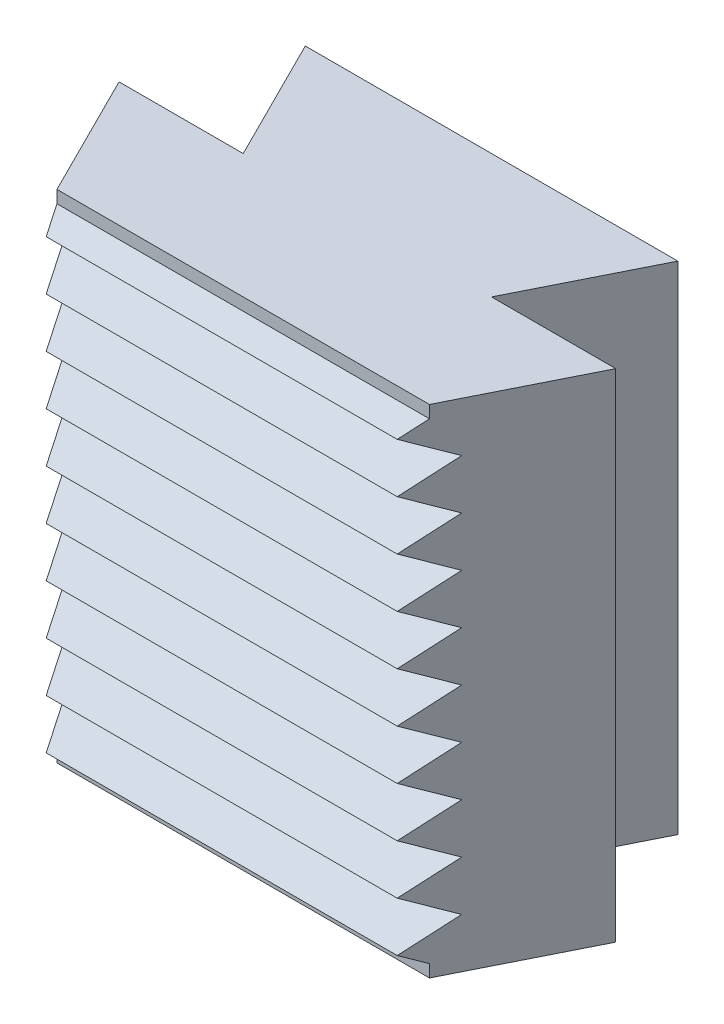
from build123d import *

# Parameters (mm, degrees)
BOSS_EXTRUDE1_DEPTH             = 5
BOSS_EXTRUDE1_DEPTH_BACK        = 5
BOSS_EXTRUDE2_REACH             = 10.66
BOSS_EXTRUDE2_DIRECTION_2_REACH = 10.66
CUT_EXTRUDE1_DEPTH              = 9.660254038
CUT_EXTRUDE1_DEPTH_BACK         = 9.660254038


with BuildPart() as part:
    # Sketch1 → Boss-Extrude1 (new, two sides: drawn at the far end of the back side and taken through both)
    with BuildSketch(Plane(origin=(0, 0, 0), x_dir=(1, 0, 0), z_dir=(0, 1, 0)).offset(-BOSS_EXTRUDE1_DEPTH_BACK)):
        Polygon((-3.75, 0), (3.75, 0), (5, 2.5), (2.5, 2.5), (3.75, 5), (-3.75, 5), (-2.5, 2.5), (-5, 2.5), align=None)
    extrude(amount=BOSS_EXTRUDE1_DEPTH + BOSS_EXTRUDE1_DEPTH_BACK)

    # Boss-Extrude2: up to this plane
    boss_extrude2_end = Plane(origin=(3.75, -5, 0), z_dir=(0.8944271909999159, 0, 0.44721359549995815))
    # Sketch3 → Boss-Extrude2 (add, up to the surface)
    with BuildSketch(Plane(origin=(0, 0, 0), x_dir=(0, 0, -1), z_dir=(1, 0, 0)), mode=Mode.PRIVATE) as boss_extrude2_sk1:
        Polygon((-0.433012702, 4.5), (0.216506351, 4.125), (0.216506351, 4.875), align=None)
    boss_extrude2_tool1 = split(extrude(boss_extrude2_sk1.sketch, amount=BOSS_EXTRUDE2_REACH, mode=Mode.PRIVATE), bisect_by=boss_extrude2_end, keep=Keep.BOTH, mode=Mode.PRIVATE)
    add(boss_extrude2_tool1.solids().sort_by_distance((0, 4.5, 0))[0])
    # Sketch3 → Boss-Extrude2 (add, up to the surface)
    with BuildSketch(Plane(origin=(0, 0, 0), x_dir=(0, 0, -1), z_dir=(1, 0, 0)), mode=Mode.PRIVATE) as boss_extrude2_sk2:
        Polygon((0.216506351, 3.875), (-0.433012702, 3.5), (0.216506351, 3.125), align=None)
    boss_extrude2_tool2 = split(extrude(boss_extrude2_sk2.sketch, amount=BOSS_EXTRUDE2_REACH, mode=Mode.PRIVATE), bisect_by=boss_extrude2_end, keep=Keep.BOTH, mode=Mode.PRIVATE)
    add(boss_extrude2_tool2.solids().sort_by_distance((0, 3.5, 0))[0])
    # Sketch3 → Boss-Extrude2 (add, up to the surface)
    with BuildSketch(Plane(origin=(0, 0, 0), x_dir=(0, 0, -1), z_dir=(1, 0, 0)), mode=Mode.PRIVATE) as boss_extrude2_sk3:
        Polygon((0.216506351, 2.875), (-0.433012702, 2.5), (0.216506351, 2.125), align=None)
    boss_extrude2_tool3 = split(extrude(boss_extrude2_sk3.sketch, amount=BOSS_EXTRUDE2_REACH, mode=Mode.PRIVATE), bisect_by=boss_extrude2_end, keep=Keep.BOTH, mode=Mode.PRIVATE)
    add(boss_extrude2_tool3.solids().sort_by_distance((0, 2.5, 0))[0])
    # Sketch3 → Boss-Extrude2 (add, up to the surface)
    with BuildSketch(Plane(origin=(0, 0, 0), x_dir=(0, 0, -1), z_dir=(1, 0, 0)), mode=Mode.PRIVATE) as boss_extrude2_sk4:
        Polygon((0.216506351, 1.875), (-0.433012702, 1.5), (0.216506351, 1.125), align=None)
    boss_extrude2_tool4 = split(extrude(boss_extrude2_sk4.sketch, amount=BOSS_EXTRUDE2_REACH, mode=Mode.PRIVATE), bisect_by=boss_extrude2_end, keep=Keep.BOTH, mode=Mode.PRIVATE)
    add(boss_extrude2_tool4.solids().sort_by_distance((0, 1.5, 0))[0])
    # Sketch3 → Boss-Extrude2 (add, up to the surface)
    with BuildSketch(Plane(origin=(0, 0, 0), x_dir=(0, 0, -1), z_dir=(1, 0, 0)), mode=Mode.PRIVATE) as boss_extrude2_sk5:
        Polygon((0.216506351, 0.875), (-0.433012702, 0.5), (0.216506351, 0.125), align=None)
    boss_extrude2_tool5 = split(extrude(boss_extrude2_sk5.sketch, amount=BOSS_EXTRUDE2_REACH, mode=Mode.PRIVATE), bisect_by=boss_extrude2_end, keep=Keep.BOTH, mode=Mode.PRIVATE)
    add(boss_extrude2_tool5.solids().sort_by_distance((0, 0.5, 0))[0])
    # Sketch3 → Boss-Extrude2 (add, up to the surface)
    with BuildSketch(Plane(origin=(0, 0, 0), x_dir=(0, 0, -1), z_dir=(1, 0, 0)), mode=Mode.PRIVATE) as boss_extrude2_sk6:
        Polygon((0.216506351, -0.125), (-0.433012702, -0.5), (0.216506351, -0.875), align=None)
    boss_extrude2_tool6 = split(extrude(boss_extrude2_sk6.sketch, amount=BOSS_EXTRUDE2_REACH, mode=Mode.PRIVATE), bisect_by=boss_extrude2_end, keep=Keep.BOTH, mode=Mode.PRIVATE)
    add(boss_extrude2_tool6.solids().sort_by_distance((0, -0.5, 0))[0])
    # Sketch3 → Boss-Extrude2 (add, up to the surface)
    with BuildSketch(Plane(origin=(0, 0, 0), x_dir=(0, 0, -1), z_dir=(1, 0, 0)), mode=Mode.PRIVATE) as boss_extrude2_sk7:
        Polygon((0.216506351, -1.125), (-0.433012702, -1.5), (0.216506351, -1.875), align=None)
    boss_extrude2_tool7 = split(extrude(boss_extrude2_sk7.sketch, amount=BOSS_EXTRUDE2_REACH, mode=Mode.PRIVATE), bisect_by=boss_extrude2_end, keep=Keep.BOTH, mode=Mode.PRIVATE)
    add(boss_extrude2_tool7.solids().sort_by_distance((0, -1.5, 0))[0])
    # Sketch3 → Boss-Extrude2 (add, up to the surface)
    with BuildSketch(Plane(origin=(0, 0, 0), x_dir=(0, 0, -1), z_dir=(1, 0, 0)), mode=Mode.PRIVATE) as boss_extrude2_sk8:
        Polygon((0.216506351, -2.125), (-0.433012702, -2.5), (0.216506351, -2.875), align=None)
    boss_extrude2_tool8 = split(extrude(boss_extrude2_sk8.sketch, amount=BOSS_EXTRUDE2_REACH, mode=Mode.PRIVATE), bisect_by=boss_extrude2_end, keep=Keep.BOTH, mode=Mode.PRIVATE)
    add(boss_extrude2_tool8.solids().sort_by_distance((0, -2.5, 0))[0])
    # Sketch3 → Boss-Extrude2 (add, up to the surface)
    with BuildSketch(Plane(origin=(0, 0, 0), x_dir=(0, 0, -1), z_dir=(1, 0, 0)), mode=Mode.PRIVATE) as boss_extrude2_sk9:
        Polygon((0.216506351, -3.125), (-0.433012702, -3.5), (0.216506351, -3.875), align=None)
    boss_extrude2_tool9 = split(extrude(boss_extrude2_sk9.sketch, amount=BOSS_EXTRUDE2_REACH, mode=Mode.PRIVATE), bisect_by=boss_extrude2_end, keep=Keep.BOTH, mode=Mode.PRIVATE)
    add(boss_extrude2_tool9.solids().sort_by_distance((0, -3.5, 0))[0])
    # Sketch3 → Boss-Extrude2 (add, up to the surface)
    with BuildSketch(Plane(origin=(0, 0, 0), x_dir=(0, 0, -1), z_dir=(1, 0, 0)), mode=Mode.PRIVATE) as boss_extrude2_sk10:
        Polygon((0.216506351, -4.125), (-0.433012702, -4.5), (0.216506351, -4.875), align=None)
    boss_extrude2_tool10 = split(extrude(boss_extrude2_sk10.sketch, amount=BOSS_EXTRUDE2_REACH, mode=Mode.PRIVATE), bisect_by=boss_extrude2_end, keep=Keep.BOTH, mode=Mode.PRIVATE)
    add(boss_extrude2_tool10.solids().sort_by_distance((0, -4.5, 0))[0])

    # Boss-Extrude2 direction 2: up to this plane
    boss_extrude2_direction_2_end = Plane(origin=(-5, -5, -2.5), z_dir=(-0.8944271909999154, 0, 0.44721359549995904))
    # Sketch3 → Boss-Extrude2 direction 2 (add, up to the surface)
    with BuildSketch(Plane(origin=(0, 0, 0), x_dir=(0, 0, -1), z_dir=(1, 0, 0)), mode=Mode.PRIVATE) as boss_extrude2_direction_2_sk1:
        Polygon((-0.433012702, 4.5), (0.216506351, 4.125), (0.216506351, 4.875), align=None)
    boss_extrude2_direction_2_tool1 = split(extrude(boss_extrude2_direction_2_sk1.sketch, amount=-BOSS_EXTRUDE2_DIRECTION_2_REACH, mode=Mode.PRIVATE), bisect_by=boss_extrude2_direction_2_end, keep=Keep.BOTH, mode=Mode.PRIVATE)
    add(boss_extrude2_direction_2_tool1.solids().sort_by_distance((0, 4.5, 0))[0])
    # Sketch3 → Boss-Extrude2 direction 2 (add, up to the surface)
    with BuildSketch(Plane(origin=(0, 0, 0), x_dir=(0, 0, -1), z_dir=(1, 0, 0)), mode=Mode.PRIVATE) as boss_extrude2_direction_2_sk2:
        Polygon((0.216506351, 3.875), (-0.433012702, 3.5), (0.216506351, 3.125), align=None)
    boss_extrude2_direction_2_tool2 = split(extrude(boss_extrude2_direction_2_sk2.sketch, amount=-BOSS_EXTRUDE2_DIRECTION_2_REACH, mode=Mode.PRIVATE), bisect_by=boss_extrude2_direction_2_end, keep=Keep.BOTH, mode=Mode.PRIVATE)
    add(boss_extrude2_direction_2_tool2.solids().sort_by_distance((0, 3.5, 0))[0])
    # Sketch3 → Boss-Extrude2 direction 2 (add, up to the surface)
    with BuildSketch(Plane(origin=(0, 0, 0), x_dir=(0, 0, -1), z_dir=(1, 0, 0)), mode=Mode.PRIVATE) as boss_extrude2_direction_2_sk3:
        Polygon((0.216506351, 2.875), (-0.433012702, 2.5), (0.216506351, 2.125), align=None)
    boss_extrude2_direction_2_tool3 = split(extrude(boss_extrude2_direction_2_sk3.sketch, amount=-BOSS_EXTRUDE2_DIRECTION_2_REACH, mode=Mode.PRIVATE), bisect_by=boss_extrude2_direction_2_end, keep=Keep.BOTH, mode=Mode.PRIVATE)
    add(boss_extrude2_direction_2_tool3.solids().sort_by_distance((0, 2.5, 0))[0])
    # Sketch3 → Boss-Extrude2 direction 2 (add, up to the surface)
    with BuildSketch(Plane(origin=(0, 0, 0), x_dir=(0, 0, -1), z_dir=(1, 0, 0)), mode=Mode.PRIVATE) as boss_extrude2_direction_2_sk4:
        Polygon((0.216506351, 1.875), (-0.433012702, 1.5), (0.216506351, 1.125), align=None)
    boss_extrude2_direction_2_tool4 = split(extrude(boss_extrude2_direction_2_sk4.sketch, amount=-BOSS_EXTRUDE2_DIRECTION_2_REACH, mode=Mode.PRIVATE), bisect_by=boss_extrude2_direction_2_end, keep=Keep.BOTH, mode=Mode.PRIVATE)
    add(boss_extrude2_direction_2_tool4.solids().sort_by_distance((0, 1.5, 0))[0])
    # Sketch3 → Boss-Extrude2 direction 2 (add, up to the surface)
    with BuildSketch(Plane(origin=(0, 0, 0), x_dir=(0, 0, -1), z_dir=(1, 0, 0)), mode=Mode.PRIVATE) as boss_extrude2_direction_2_sk5:
        Polygon((0.216506351, 0.875), (-0.433012702, 0.5), (0.216506351, 0.125), align=None)
    boss_extrude2_direction_2_tool5 = split(extrude(boss_extrude2_direction_2_sk5.sketch, amount=-BOSS_EXTRUDE2_DIRECTION_2_REACH, mode=Mode.PRIVATE), bisect_by=boss_extrude2_direction_2_end, keep=Keep.BOTH, mode=Mode.PRIVATE)
    add(boss_extrude2_direction_2_tool5.solids().sort_by_distance((0, 0.5, 0))[0])
    # Sketch3 → Boss-Extrude2 direction 2 (add, up to the surface)
    with BuildSketch(Plane(origin=(0, 0, 0), x_dir=(0, 0, -1), z_dir=(1, 0, 0)), mode=Mode.PRIVATE) as boss_extrude2_direction_2_sk6:
        Polygon((0.216506351, -0.125), (-0.433012702, -0.5), (0.216506351, -0.875), align=None)
    boss_extrude2_direction_2_tool6 = split(extrude(boss_extrude2_direction_2_sk6.sketch, amount=-BOSS_EXTRUDE2_DIRECTION_2_REACH, mode=Mode.PRIVATE), bisect_by=boss_extrude2_direction_2_end, keep=Keep.BOTH, mode=Mode.PRIVATE)
    add(boss_extrude2_direction_2_tool6.solids().sort_by_distance((0, -0.5, 0))[0])
    # Sketch3 → Boss-Extrude2 direction 2 (add, up to the surface)
    with BuildSketch(Plane(origin=(0, 0, 0), x_dir=(0, 0, -1), z_dir=(1, 0, 0)), mode=Mode.PRIVATE) as boss_extrude2_direction_2_sk7:
        Polygon((0.216506351, -1.125), (-0.433012702, -1.5), (0.216506351, -1.875), align=None)
    boss_extrude2_direction_2_tool7 = split(extrude(boss_extrude2_direction_2_sk7.sketch, amount=-BOSS_EXTRUDE2_DIRECTION_2_REACH, mode=Mode.PRIVATE), bisect_by=boss_extrude2_direction_2_end, keep=Keep.BOTH, mode=Mode.PRIVATE)
    add(boss_extrude2_direction_2_tool7.solids().sort_by_distance((0, -1.5, 0))[0])
    # Sketch3 → Boss-Extrude2 direction 2 (add, up to the surface)
    with BuildSketch(Plane(origin=(0, 0, 0), x_dir=(0, 0, -1), z_dir=(1, 0, 0)), mode=Mode.PRIVATE) as boss_extrude2_direction_2_sk8:
        Polygon((0.216506351, -2.125), (-0.433012702, -2.5), (0.216506351, -2.875), align=None)
    boss_extrude2_direction_2_tool8 = split(extrude(boss_extrude2_direction_2_sk8.sketch, amount=-BOSS_EXTRUDE2_DIRECTION_2_REACH, mode=Mode.PRIVATE), bisect_by=boss_extrude2_direction_2_end, keep=Keep.BOTH, mode=Mode.PRIVATE)
    add(boss_extrude2_direction_2_tool8.solids().sort_by_distance((0, -2.5, 0))[0])
    # Sketch3 → Boss-Extrude2 direction 2 (add, up to the surface)
    with BuildSketch(Plane(origin=(0, 0, 0), x_dir=(0, 0, -1), z_dir=(1, 0, 0)), mode=Mode.PRIVATE) as boss_extrude2_direction_2_sk9:
        Polygon((0.216506351, -3.125), (-0.433012702, -3.5), (0.216506351, -3.875), align=None)
    boss_extrude2_direction_2_tool9 = split(extrude(boss_extrude2_direction_2_sk9.sketch, amount=-BOSS_EXTRUDE2_DIRECTION_2_REACH, mode=Mode.PRIVATE), bisect_by=boss_extrude2_direction_2_end, keep=Keep.BOTH, mode=Mode.PRIVATE)
    add(boss_extrude2_direction_2_tool9.solids().sort_by_distance((0, -3.5, 0))[0])
    # Sketch3 → Boss-Extrude2 direction 2 (add, up to the surface)
    with BuildSketch(Plane(origin=(0, 0, 0), x_dir=(0, 0, -1), z_dir=(1, 0, 0)), mode=Mode.PRIVATE) as boss_extrude2_direction_2_sk10:
        Polygon((0.216506351, -4.125), (-0.433012702, -4.5), (0.216506351, -4.875), align=None)
    boss_extrude2_direction_2_tool10 = split(extrude(boss_extrude2_direction_2_sk10.sketch, amount=-BOSS_EXTRUDE2_DIRECTION_2_REACH, mode=Mode.PRIVATE), bisect_by=boss_extrude2_direction_2_end, keep=Keep.BOTH, mode=Mode.PRIVATE)
    add(boss_extrude2_direction_2_tool10.solids().sort_by_distance((0, -4.5, 0))[0])

    # Sketch4 → Cut-Extrude1 (cut, two sides: drawn at the far end of the back side and taken through both)
    with BuildSketch(Plane(origin=(0, 0, 0), x_dir=(0, 0, -1), z_dir=(1, 0, 0)).offset(-CUT_EXTRUDE1_DEPTH_BACK)):
        Polygon((0.433012702, 4), (-0.216506351, 4.375), (-0.216506351, 3.625), align=None)
        Polygon((-0.216506351, 2.625), (0.433012702, 3), (-0.216506351, 3.375), align=None)
        Polygon((-0.216506351, 1.625), (0.433012702, 2), (-0.216506351, 2.375), align=None)
        Polygon((-0.216506351, 0.625), (0.433012702, 1), (-0.216506351, 1.375), align=None)
        Polygon((-0.216506351, -0.375), (0.433012702, 0), (-0.216506351, 0.375), align=None)
        Polygon((-0.216506351, -1.375), (0.433012702, -1), (-0.216506351, -0.625), align=None)
        Polygon((-0.216506351, -2.375), (0.433012702, -2), (-0.216506351, -1.625), align=None)
        Polygon((-0.216506351, -3.375), (0.433012702, -3), (-0.216506351, -2.625), align=None)
        Polygon((-0.216506351, -4.375), (0.433012702, -4), (-0.216506351, -3.625), align=None)
    extrude(amount=CUT_EXTRUDE1_DEPTH + CUT_EXTRUDE1_DEPTH_BACK, mode=Mode.SUBTRACT)


solid = part.part
